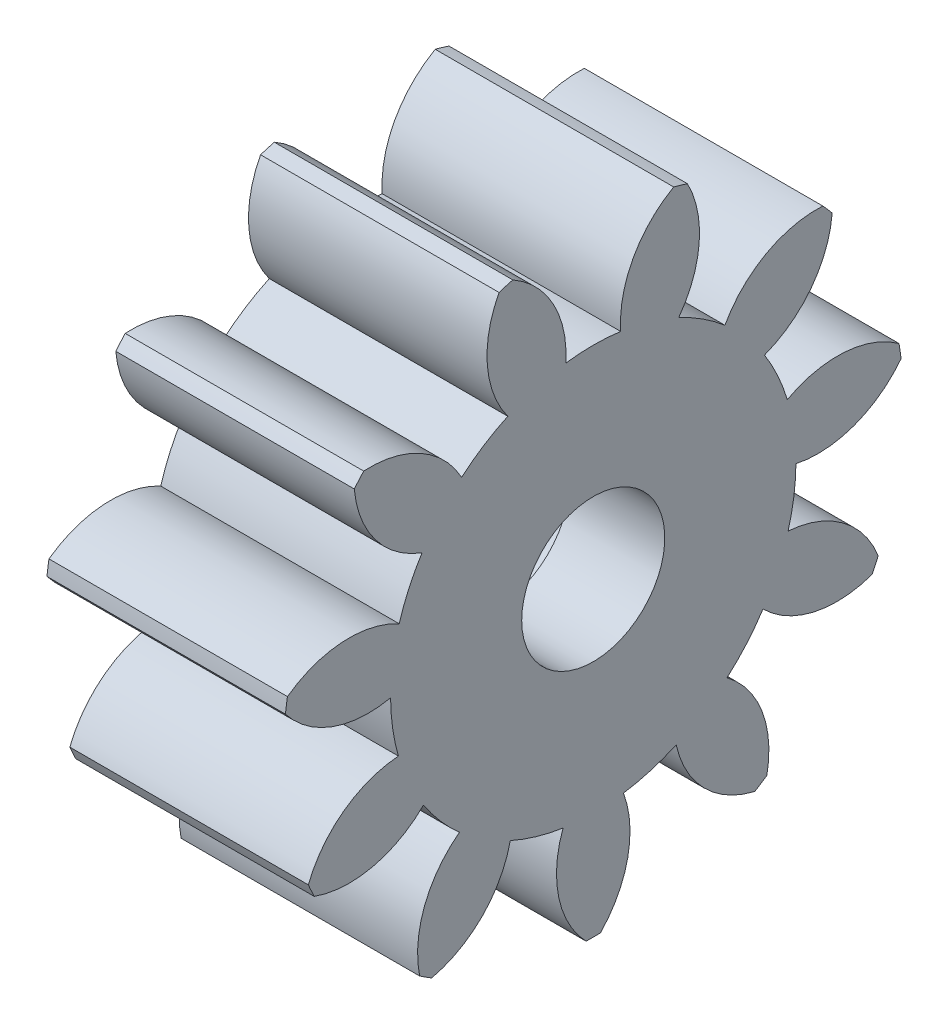
from build123d import *

# Parameters (mm, degrees)
BASPROSKE_W             = 5
BASPROSKE_H             = 6.5
TOOTHCUT_DEPTH          = 11.464224768
TEETHCUTS_COUNT         = 11
TEETHCUTS_ANGLE         = 327.272727273
BORSKE_R                = 1.5
BORE_DEPTH              = 50.0000508
ESQUISSE1_R             = 2.75
ENL_V_MAT_EXTRU_1_DEPTH = 3


with BuildPart() as part:
    # BasProSke → Base-Revolve (revolve)
    with BuildSketch(Plane(origin=(0, 0, 0), x_dir=(1, 0, 0), z_dir=(0, 1, 0)), mode=Mode.PRIVATE) as base_revolve_sk:
        with Locations((2.5, 3.25)):
            Rectangle(BASPROSKE_W, BASPROSKE_H)
    revolve(base_revolve_sk.sketch.rotate(Axis((-10, 0, 0), (1, 0, 0)), 180), axis=Axis((-10, 0, 0), (1, 0, 0)))

    # TooCutSke → ToothCut (cut, through all)
    with BuildSketch(Plane(origin=(0, 0, 0), x_dir=(0, 0, -1), z_dir=(1, 0, 0))):
        with BuildLine():
            ThreePointArc((0.576045815, 4.209771041), (0, 4.249), (-0.576045815, 4.209771041))
            ThreePointArc((-0.576045815, 4.209771041), (-0.841371334, 5.420048739), (-1.718652745, 6.295004202))
            ThreePointArc((-1.718652745, 6.295004202), (0, 6.5254), (1.718652745, 6.295004202))
            ThreePointArc((1.718652745, 6.295004202), (0.841371334, 5.420048739), (0.576045815, 4.209771041))
        make_face()
    toothcut = extrude(amount=TOOTHCUT_DEPTH, mode=Mode.SUBTRACT)

    # TeethCuts: ToothCut ×11 about axis
    teethcuts_axis = Axis((-10, 0, 0), (1, 0, 0))
    for i in range(1, TEETHCUTS_COUNT):
        add(toothcut.rotate(teethcuts_axis, i * TEETHCUTS_ANGLE / (TEETHCUTS_COUNT - 1)), mode=Mode.SUBTRACT)

    # BorSke → Bore (cut, symmetric)
    with BuildSketch(Plane(origin=(0, 0, 0), x_dir=(0, 0, -1), z_dir=(1, 0, 0))):
        with Locations(Location((0, 0, 0), (0, 0, 180))):
            Circle(BORSKE_R)
    extrude(amount=BORE_DEPTH, both=True, mode=Mode.SUBTRACT)

    # Esquisse1 → Enlèv. mat.-Extru.1 (cut)
    with BuildSketch(Plane.ZY):
        Circle(ESQUISSE1_R)
    extrude(amount=-ENL_V_MAT_EXTRU_1_DEPTH, mode=Mode.SUBTRACT)


solid = part.part
